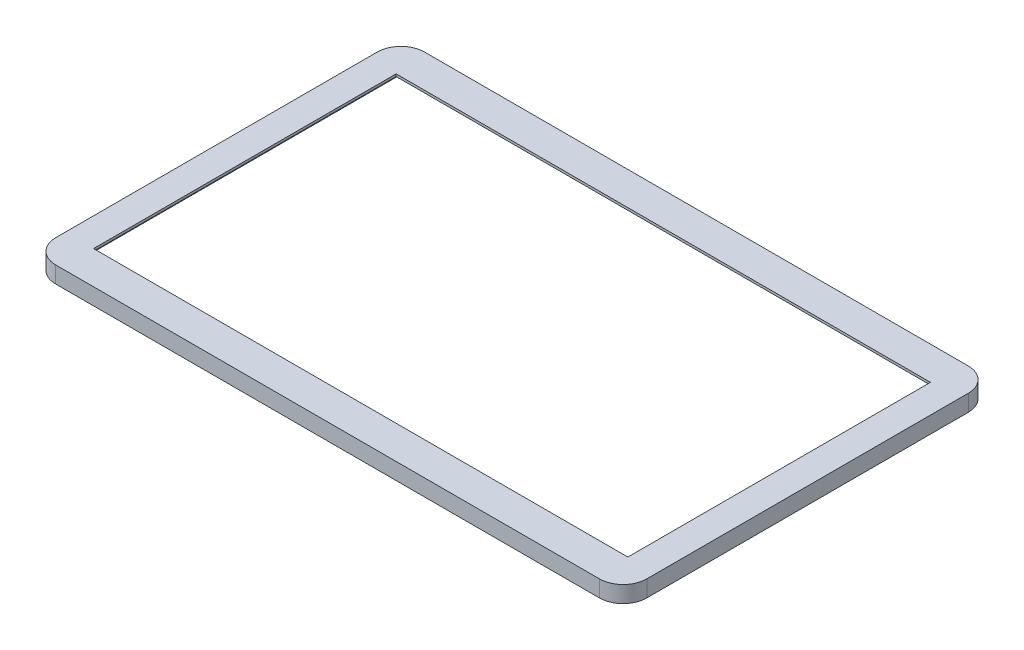
from build123d import *

# Parameters (mm, degrees)
SKETCH_1_W          = 250
SKETCH_1_H          = 156
SKETCH_1_W_2        = 226
SKETCH_1_H_2        = 128
EXTRUDE_1_DEPTH     = 8
SKETCH_2_W          = 235.5
SKETCH_2_H          = 139.5
CUT_EXTRUDE_3_DEPTH = 6
CUT_EXTRUDE_4_DEPTH = 10
CUT_EXTRUDE_5_DEPTH = 10
SKETCH_6_W          = 250
SKETCH_6_H          = 156
CUT_EXTRUDE_6_DEPTH = 1


with BuildPart() as part:
    # 草图1 → 凸台-拉伸1 (new body)
    with BuildSketch(Plane(origin=(0, 0, 0), x_dir=(1, 0, 0), z_dir=(0, 1, 0))):
        with Locations((25.659327926, -14.898030127)):
            Rectangle(SKETCH_1_W, SKETCH_1_H)
        with Locations((25.659327926, -14.898030127)):
            Rectangle(SKETCH_1_W_2, SKETCH_1_H_2, mode=Mode.SUBTRACT)
    extrude(amount=EXTRUDE_1_DEPTH)

    # 草图2 → 切除-拉伸3 (cut)
    with BuildSketch(Plane.XZ):
        with Locations((24.659327926, 12.898030127)):
            Rectangle(SKETCH_2_W, SKETCH_2_H)
    extrude(amount=-CUT_EXTRUDE_3_DEPTH, mode=Mode.SUBTRACT)

    # 草图3 → 切除-拉伸4 (cut)
    with BuildSketch(Plane(origin=(0, 8, 0), x_dir=(1, 0, 0), z_dir=(0, 1, 0))):
        with BuildLine():
            Line((-89.340672074, 63.101969873), (-99.340672074, 63.101969873))
            Line((-99.340672074, 63.101969873), (-99.340672074, 53.101969873))
            ThreePointArc((-99.340672074, 53.101969873), (-96.411739886, 60.173037684), (-89.340672074, 63.101969873))
        make_face()
    extrude(amount=-CUT_EXTRUDE_4_DEPTH, mode=Mode.SUBTRACT)

    # 草图4 → 切除-拉伸5 (cut)
    with BuildSketch(Plane(origin=(0, 8, 0), x_dir=(1, 0, 0), z_dir=(0, 1, 0))):
        with BuildLine():
            Line((-99.340672074, -82.898030127), (-99.340672074, -92.898030127))
            Line((-99.340672074, -92.898030127), (-89.340672074, -92.898030127))
            ThreePointArc((-89.340672074, -92.898030127), (-96.411739886, -89.969097939), (-99.340672074, -82.898030127))
        make_face()
        with BuildLine():
            Line((150.659327926, -82.898030127), (150.659327926, -92.898030127))
            Line((150.659327926, -92.898030127), (140.659327926, -92.898030127))
            ThreePointArc((140.659327926, -92.898030127), (147.730395738, -89.969097939), (150.659327926, -82.898030127))
        make_face()
        with BuildLine():
            Line((140.659327926, 63.101969873), (150.659327926, 63.101969873))
            Line((150.659327926, 63.101969873), (150.659327926, 53.101969873))
            ThreePointArc((150.659327926, 53.101969873), (147.730395738, 60.173037684), (140.659327926, 63.101969873))
        make_face()
    extrude(amount=-CUT_EXTRUDE_5_DEPTH, mode=Mode.SUBTRACT)

    # 草图6 → 切除-拉伸6 (cut)
    with BuildSketch(Plane(origin=(0, 8, 0), x_dir=(1, 0, 0), z_dir=(0, 1, 0))):
        with Locations((25.659327926, -14.898030127)):
            Rectangle(SKETCH_6_W, SKETCH_6_H)
    extrude(amount=-CUT_EXTRUDE_6_DEPTH, mode=Mode.SUBTRACT)


solid = part.part
